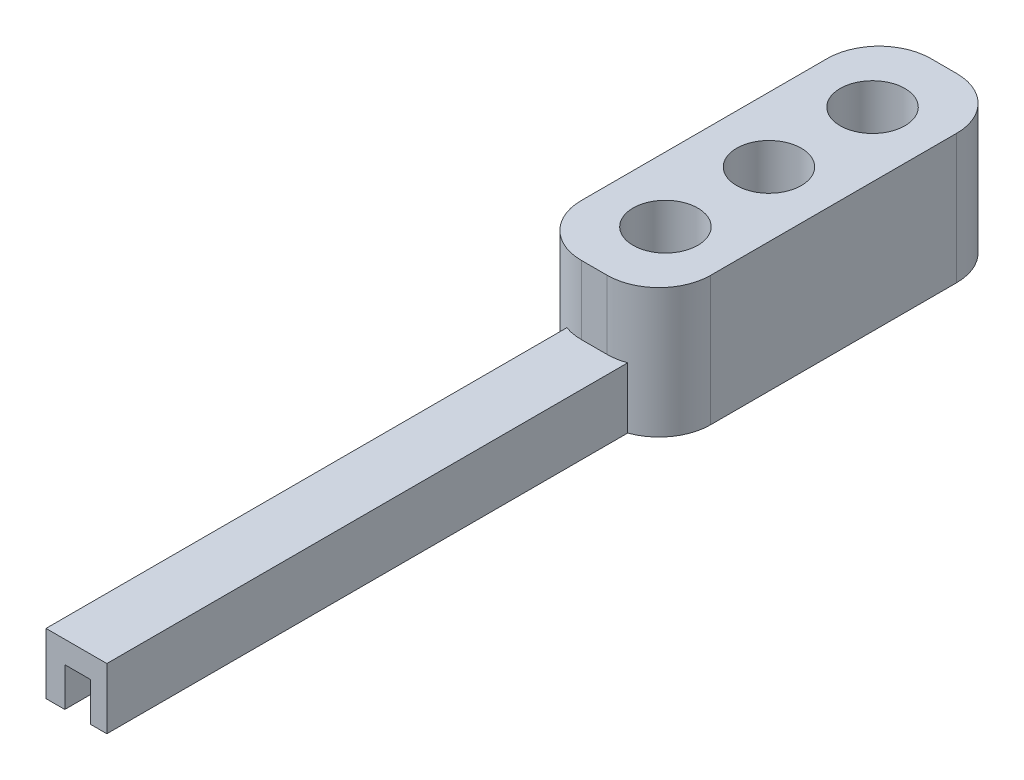
from build123d import *

# Parameters (mm, degrees)
SKETCH1_W           = 10
SKETCH1_H           = 27
BOSS_EXTRUDE1_DEPTH = 10
SKETCH2_R           = 2.5
CUT_EXTRUDE1_DEPTH  = 10
SKETCH3_W           = 4.7
SKETCH3_H           = 4.7
BOSS_EXTRUDE2_DEPTH = 40
SKETCH4_W           = 2
SKETCH4_H           = 62
CUT_EXTRUDE3_DEPTH  = 3
FILLET1_R           = 4
SKETCH5_R           = 3
CUT_EXTRUDE4_DEPTH  = 3
CUT_EXTRUDE5_DEPTH  = 3


with BuildPart() as part:
    # Sketch1 → Boss-Extrude1 (new body)
    with BuildSketch(Plane(origin=(0, 0, 0), x_dir=(1, 0, 0), z_dir=(0, 1, 0))):
        with Locations((0.146426278, 10.467599094)):
            Rectangle(SKETCH1_W, SKETCH1_H)
    extrude(amount=BOSS_EXTRUDE1_DEPTH)

    # Sketch2 → Cut-Extrude1 (cut)
    with BuildSketch(Plane(origin=(0, 10, 0), x_dir=(1, 0, 0), z_dir=(0, 1, 0))):
        with Locations(Location((0.146426278, 18.467599094, 0), (0, 0, 270))):
            Circle(SKETCH2_R)
        with Locations(Location((0.146426278, 10.467599094, 0), (0, 0, 270))):
            Circle(SKETCH2_R)
        with Locations(Location((0.146426278, 2.467599094, 0), (0, 0, 270))):
            Circle(SKETCH2_R)
    extrude(amount=-CUT_EXTRUDE1_DEPTH, mode=Mode.SUBTRACT)

    # Sketch3 → Boss-Extrude2 (add)
    with BuildSketch(Plane.XY.offset(3.032400906)):
        with Locations((0.146426278, 2.35)):
            Rectangle(SKETCH3_W, SKETCH3_H)
    extrude(amount=BOSS_EXTRUDE2_DEPTH)

    # Sketch4 → Cut-Extrude3 (cut)
    with BuildSketch(Plane(origin=(0, 0, 0), x_dir=(-1, 0, 0), z_dir=(0, -1, 0))):
        with Locations((-0.246426278, -12.032400906)):
            Rectangle(SKETCH4_W, SKETCH4_H)
    extrude(amount=-CUT_EXTRUDE3_DEPTH, mode=Mode.SUBTRACT)

    # Fillet1
    fillet1_edges = [part.edges().sort_by_distance(p)[0] for p in [
        (5.146426278, 5, 3.032400906),
        (-4.853573722, 5, 3.032400906),
        (-4.853573722, 5, -23.967599094),
        (5.146426278, 5, -23.967599094),
    ]]
    fillet(fillet1_edges, radius=FILLET1_R)

    # Sketch5 → Cut-Extrude4 (cut)
    with BuildSketch(Plane(origin=(0, 0, 0), x_dir=(-1, 0, 0), z_dir=(0, -1, 0))):
        with Locations((-0.146426278, 18.467599094)):
            Circle(SKETCH5_R)
        with Locations((-0.146426278, 10.467599094)):
            Circle(SKETCH5_R)
        with Locations((-0.146426278, 2.467599094)):
            Circle(SKETCH5_R)
    extrude(amount=-CUT_EXTRUDE4_DEPTH, mode=Mode.SUBTRACT)

    # Sketch6 → Cut-Extrude5 (cut)
    with BuildSketch(Plane(origin=(0, 0, 0), x_dir=(-1, 0, 0), z_dir=(0, -1, 0))):
        Polygon((-0.146426278, 18.467599094), (-0.146426278, 18.967599094), (4.853573722, 18.967599094), (4.853573722, 18.467599094), (4.853573722, 17.967599094), (-0.146426278, 17.967599094), align=None)
        Polygon((-0.146426278, 10.467599094), (-0.146426278, 10.967599094), (4.853573722, 10.967599094), (4.853573722, 10.467599094), (4.853573722, 9.967599094), (-0.146426278, 9.967599094), align=None)
        Polygon((-0.146426278, 2.467599094), (-0.146426278, 2.967599094), (4.853573722, 2.967599094), (4.853573722, 2.467599094), (4.853573722, 1.967599094), (-0.146426278, 1.967599094), align=None)
    extrude(amount=-CUT_EXTRUDE5_DEPTH, mode=Mode.SUBTRACT)


solid = part.part
